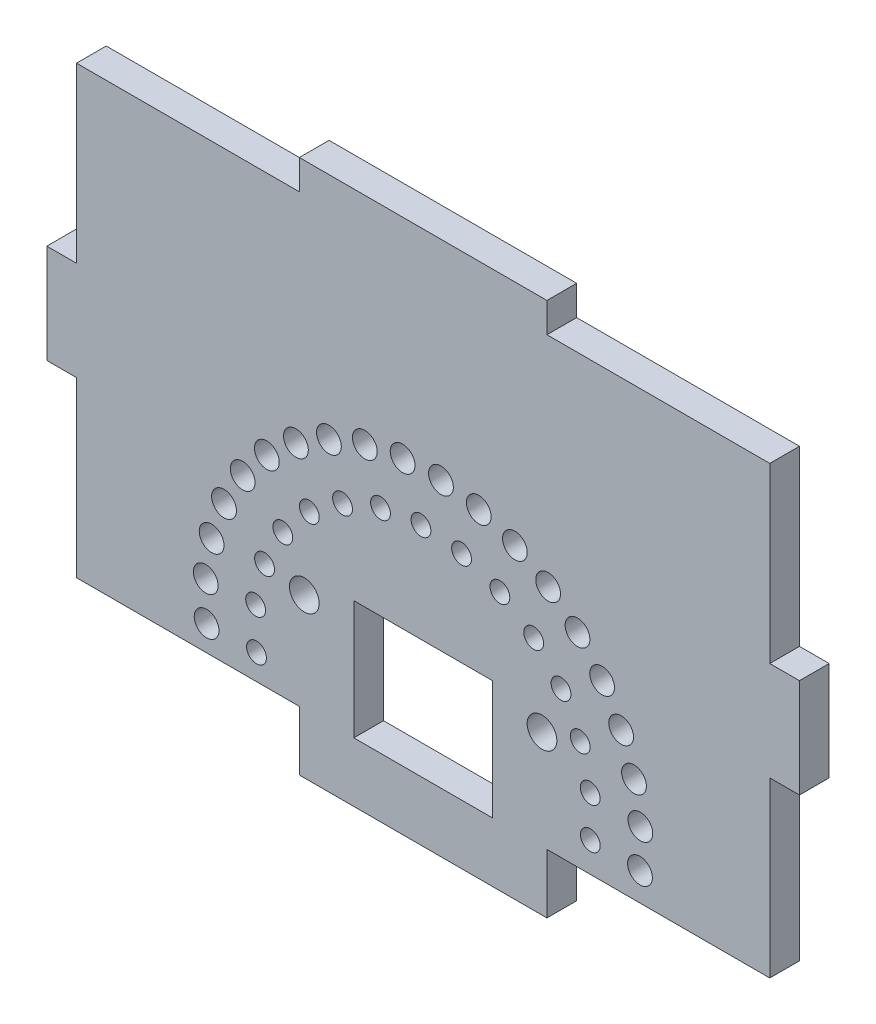
from build123d import *

# Parameters (mm, degrees)
BOSS_EXTRUDE1_DEPTH = 3
SKETCH2_R           = 1.5
SKETCH2_W           = 14
SKETCH2_H           = 12
CUT_EXTRUDE1_DEPTH  = 88.418533504
SKETCH3_R           = 1
SKETCH3_R_2         = 1.25
CUT_EXTRUDE2_DEPTH  = 88.418533504


with BuildPart() as part:
    # Sketch1 → Boss-Extrude1 (new body)
    with BuildSketch(Plane.XY):
        Polygon((0, 0), (22.5, 0), (22.5, -6), (47.5, -6), (47.5, 0), (70, 0), (70, 17.5), (73, 17.5), (73, 27.5), (70, 27.5), (70, 45), (47.5, 45), (47.5, 48), (22.5, 48), (22.5, 45), (0, 45), (0, 27.5), (-3, 27.5), (-3, 17.5), (0, 17.5), align=None)
    extrude(amount=BOSS_EXTRUDE1_DEPTH)

    # Sketch2 → Cut-Extrude1 (cut, through all)
    with BuildSketch(Plane.XY.offset(3)):
        with Locations((23, 10)):
            Circle(SKETCH2_R)
        with Locations((47, 10)):
            Circle(SKETCH2_R)
        with Locations((35, 6)):
            Rectangle(SKETCH2_W, SKETCH2_H)
    extrude(amount=-CUT_EXTRUDE1_DEPTH, mode=Mode.SUBTRACT)

    # Sketch3 → Cut-Extrude2 (cut, through all)
    with BuildSketch(Plane(origin=(0, 0, 0), x_dir=(-1, 0, 0), z_dir=(0, 0, -1))):
        with Locations((-51.881943016, 3)):
            Circle(SKETCH3_R)
        with Locations((-51.866980094, 7.122494405)):
            Circle(SKETCH3_R)
        with Locations((-50.860122949, 11.120171569)):
            Circle(SKETCH3_R)
        with Locations((-48.920581694, 14.757940628)):
            Circle(SKETCH3_R)
        with Locations((-46.162414669, 17.82187579)):
            Circle(SKETCH3_R)
        with Locations((-42.74782103, 20.131796631)):
            Circle(SKETCH3_R)
        with Locations((-38.877602325, 21.55186395)):
            Circle(SKETCH3_R)
        with Locations((-34.779353984, 21.998568038)):
            Circle(SKETCH3_R)
        with Locations((-30.694081142, 21.445639629)):
            Circle(SKETCH3_R)
        with Locations((-26.862025891, 19.925594708)):
            Circle(SKETCH3_R)
        with Locations((-23.508539385, 17.527822354)):
            Circle(SKETCH3_R)
        with Locations((-20.830829653, 14.39332804)):
            Circle(SKETCH3_R)
        with Locations((-18.98636441, 10.706441551)):
            Circle(SKETCH3_R)
        with Locations((-18.083610875, 6.683977124)):
            Circle(SKETCH3_R)
        with Locations((-18.175657153, 2.562483282)):
            Circle(SKETCH3_R)
        with Locations((-13.135450788, 2.562483282)):
            Circle(SKETCH3_R_2)
        with Locations((-13.046954317, 6.436588053)):
            Circle(SKETCH3_R_2)
        with Locations((-13.639570111, 10.266121435)):
            Circle(SKETCH3_R_2)
        with Locations((-14.894911752, 13.932268836)):
            Circle(SKETCH3_R_2)
        with Locations((-16.774031178, 17.321284856)):
            Circle(SKETCH3_R_2)
        with Locations((-19.21862708, 20.328022337)):
            Circle(SKETCH3_R_2)
        with Locations((-22.152853752, 22.859194643)):
            Circle(SKETCH3_R_2)
        with Locations((-25.485674269, 24.836269959)):
            Circle(SKETCH3_R_2)
        with Locations((-29.113684986, 26.197907811)):
            Circle(SKETCH3_R_2)
        with Locations((-32.924323727, 26.901862204)):
            Circle(SKETCH3_R_2)
        with Locations((-36.799362123, 26.926292344)):
            Circle(SKETCH3_R_2)
        with Locations((-40.61857375, 26.270440264)):
            Circle(SKETCH3_R_2)
        with Locations((-44.263464258, 24.954654343)):
            Circle(SKETCH3_R_2)
        with Locations((-47.62094776, 23.01975798)):
            Circle(SKETCH3_R_2)
        with Locations((-50.586855421, 20.52578301)):
            Circle(SKETCH3_R_2)
        with Locations((-53.069167386, 17.550107169)):
            Circle(SKETCH3_R_2)
        with Locations((-54.990867776, 14.185053378)):
            Circle(SKETCH3_R_2)
        with Locations((-56.29233417, 10.535025347)):
            Circle(SKETCH3_R_2)
        with Locations((-56.933187446, 6.713268358)):
            Circle(SKETCH3_R_2)
        with Locations((-56.893544575, 2.838355734)):
            Circle(SKETCH3_R_2)
    extrude(amount=-CUT_EXTRUDE2_DEPTH, mode=Mode.SUBTRACT)


solid = part.part
